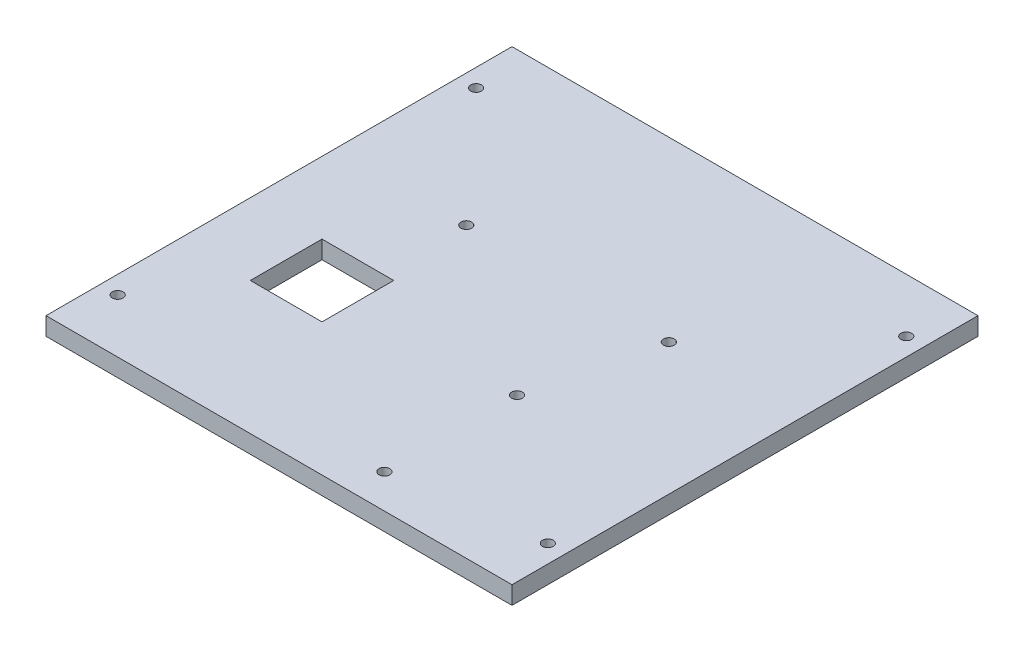
from build123d import *

# Parameters (mm, degrees)
SKETCH1_W           = 130
SKETCH1_H           = 130
BOSS_EXTRUDE1_DEPTH = 5
SKETCH2_R           = 1.5
CUT_EXTRUDE1_DEPTH  = 5
SKETCH3_R           = 1.5
CUT_EXTRUDE2_DEPTH  = 5
SKETCH4_R           = 1.5
CUT_EXTRUDE3_DEPTH  = 5
SKETCH5_W           = 20
SKETCH5_H           = 20
CUT_EXTRUDE4_DEPTH  = 5


with BuildPart() as part:
    # Sketch1 → Boss-Extrude1 (new body)
    with BuildSketch(Plane(origin=(0, 0, 0), x_dir=(1, 0, 0), z_dir=(0, 1, 0))):
        Rectangle(SKETCH1_W, SKETCH1_H)
    extrude(amount=BOSS_EXTRUDE1_DEPTH)

    # Sketch2 → Cut-Extrude1 (cut)
    with BuildSketch(Plane.XZ):
        with Locations(Location((19.9, 55.5, 0), (0, 0, 270))):
            Circle(SKETCH2_R)
        with Locations(Location((19.9, 18.5, 0), (0, 0, 270))):
            Circle(SKETCH2_R)
    extrude(amount=-CUT_EXTRUDE1_DEPTH, mode=Mode.SUBTRACT)

    # Sketch3 → Cut-Extrude2 (cut)
    with BuildSketch(Plane(origin=(0, 5, 0), x_dir=(1, 0, 0), z_dir=(0, 1, 0))):
        with Locations(Location((-28.25, 15.5, 0), (0, 0, 270))):
            Circle(SKETCH3_R)
        with Locations(Location((28.25, 15.5, 0), (0, 0, 270))):
            Circle(SKETCH3_R)
    extrude(amount=-CUT_EXTRUDE2_DEPTH, mode=Mode.SUBTRACT)

    # Sketch4 → Cut-Extrude3 (cut)
    with BuildSketch(Plane(origin=(0, 5, 0), x_dir=(1, 0, 0), z_dir=(0, 1, 0))):
        with Locations(Location((-60, 50, 0), (0, 0, 270))):
            Circle(SKETCH4_R)
        with Locations(Location((60, 50, 0), (0, 0, 270))):
            Circle(SKETCH4_R)
        with Locations(Location((60, -50, 0), (0, 0, 270))):
            Circle(SKETCH4_R)
        with Locations(Location((-60, -50, 0), (0, 0, 270))):
            Circle(SKETCH4_R)
    extrude(amount=-CUT_EXTRUDE3_DEPTH, mode=Mode.SUBTRACT)

    # Sketch5 → Cut-Extrude4 (cut)
    with BuildSketch(Plane(origin=(0, 5, 0), x_dir=(1, 0, 0), z_dir=(0, 1, 0))):
        with Locations((-35, -18)):
            Rectangle(SKETCH5_W, SKETCH5_H)
    extrude(amount=-CUT_EXTRUDE4_DEPTH, mode=Mode.SUBTRACT)


solid = part.part
